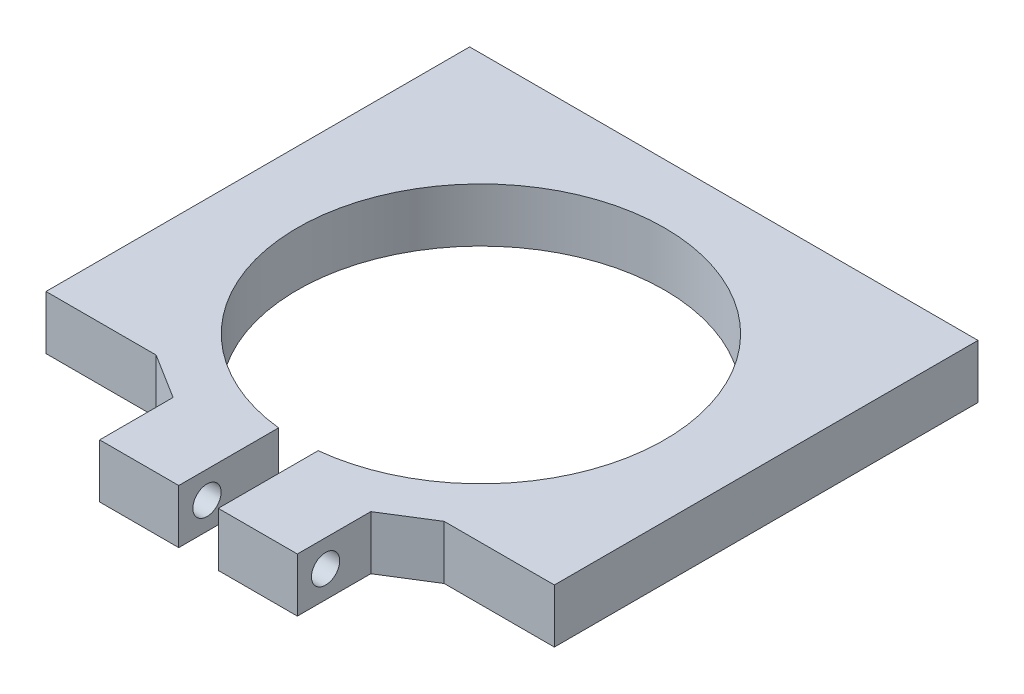
from build123d import *

# Parameters (mm, degrees)
ESBO_O1_W                = 90
ESBO_O1_H                = 93
RESSALTO_EXTRUS_O1_DEPTH = 9.53
ESBO_O3_R                = 32.51
CORTE_EXTRUS_O2_DEPTH    = 66.406963697
ESBO_O2_R                = 2
CORTE_EXTRUS_O1_DEPTH    = 19
CORTE_EXTRUS_O4_REACH    = 67.407
ESBO_O5_W                = 27.5
ESBO_O5_H                = 13
CORTE_EXTRUS_O5_REACH    = 67.407
ESBO_O6_W                = 7
ESBO_O6_H                = 26.329700269
CORTE_EXTRUS_O6_REACH    = 80.481
ESBO_O7_R                = 2.5
CORTE_EXTRUS_O8_DEPTH    = 66.406963697


with BuildPart() as part:
    # Esboço1 → Ressalto-extrusão1 (new body)
    with BuildSketch(Plane(origin=(0, 0, 0), x_dir=(1, 0, 0), z_dir=(0, 1, 0))):
        Rectangle(ESBO_O1_W, ESBO_O1_H)
    extrude(amount=RESSALTO_EXTRUS_O1_DEPTH)

    # Esboço3 → Corte-extrusão2 (cut, through all)
    with BuildSketch(Plane(origin=(0, 9.53, 0), x_dir=(1, 0, 0), z_dir=(0, 1, 0))):
        with Locations(Location((0, 3.5, 0), (0, 0, 270))):
            Circle(ESBO_O3_R)
    extrude(amount=-CORTE_EXTRUS_O2_DEPTH, mode=Mode.SUBTRACT)

    # Esboço2 → Corte-extrusão1 (cut)
    with BuildSketch(Plane(origin=(0, 0, -46.5), x_dir=(-1, 0, 0), z_dir=(0, 0, -1))):
        with Locations((-40, 4.765)):
            Circle(ESBO_O2_R)
        with Locations((-25, 4.765)):
            Circle(ESBO_O2_R)
        with Locations((25, 4.765)):
            Circle(ESBO_O2_R)
        with Locations((40, 4.765)):
            Circle(ESBO_O2_R)
    extrude(amount=-CORTE_EXTRUS_O1_DEPTH, mode=Mode.SUBTRACT)

    # Esboço5 → Corte-extrusão4 (cut, up to next)
    with BuildSketch(Plane(origin=(0, 9.53, 0), x_dir=(1, 0, 0), z_dir=(0, 1, 0)), mode=Mode.PRIVATE) as corte_extrus_o4_sk1:
        with Locations((31.25, -40)):
            Rectangle(ESBO_O5_W, ESBO_O5_H)
    corte_extrus_o4_tool1 = extrude(corte_extrus_o4_sk1.sketch, amount=-CORTE_EXTRUS_O4_REACH, mode=Mode.PRIVATE) & part.part
    # Esboço5 → Corte-extrusão4 (cut, up to next)
    with BuildSketch(Plane(origin=(0, 9.53, 0), x_dir=(1, 0, 0), z_dir=(0, 1, 0)), mode=Mode.PRIVATE) as corte_extrus_o4_sk2:
        with Locations((-31.25, -40)):
            Rectangle(ESBO_O5_W, ESBO_O5_H)
    corte_extrus_o4_tool2 = extrude(corte_extrus_o4_sk2.sketch, amount=-CORTE_EXTRUS_O4_REACH, mode=Mode.PRIVATE) & part.part
    add(corte_extrus_o4_tool1.solids().sort_by_distance((31.25, 9.53, 40))[0], mode=Mode.SUBTRACT)
    add(corte_extrus_o4_tool2.solids().sort_by_distance((-31.25, 9.53, 40))[0], mode=Mode.SUBTRACT)

    # Esboço6 → Corte-extrusão5 (cut, up to next)
    with BuildSketch(Plane(origin=(0, 9.53, 0), x_dir=(1, 0, 0), z_dir=(0, 1, 0)), mode=Mode.PRIVATE) as corte_extrus_o5_sk1:
        with Locations((0, -33.335149866)):
            Rectangle(ESBO_O6_W, ESBO_O6_H)
    corte_extrus_o5_tool1 = extrude(corte_extrus_o5_sk1.sketch, amount=-CORTE_EXTRUS_O5_REACH, mode=Mode.PRIVATE) & part.part
    add(corte_extrus_o5_tool1.solids().sort_by_distance((0, 9.53, 33.33515))[0], mode=Mode.SUBTRACT)

    # Corte-extrusão6: up to this face of the body (flat: up to its plane)
    corte_extrus_o6_end = Plane(part.part.faces().sort_by_distance((17.5, 4.765, 40))[0])
    # Esboço7 → Corte-extrusão6 (cut, up to the picked face)
    with BuildSketch(Plane.ZY.offset(17.5), mode=Mode.PRIVATE) as corte_extrus_o6_sk1:
        with Locations((41.5, 4.765)):
            Circle(ESBO_O7_R)
    corte_extrus_o6_tool1 = split(extrude(corte_extrus_o6_sk1.sketch, amount=-CORTE_EXTRUS_O6_REACH, mode=Mode.PRIVATE), bisect_by=corte_extrus_o6_end, keep=Keep.BOTH, mode=Mode.PRIVATE)
    add(corte_extrus_o6_tool1.solids().sort_by(Axis((-17.5, 4.765, 41.5), (1, 0, 0)))[0], mode=Mode.SUBTRACT)

    # Esboço9 → Corte-extrusão8 (cut, through all)
    with BuildSketch(Plane(origin=(0, 9.53, 0), x_dir=(-1, 0, 0), z_dir=(0, 1, 0))):
        Polygon((45, 28.5), (25.5, 28.5), (17.5, 33.5), (45, 33.5), align=None)
        Polygon((-25.5, 28.5), (-17.5, 33.5), (-45, 33.5), (-45, 28.5), align=None)
    extrude(amount=-CORTE_EXTRUS_O8_DEPTH, mode=Mode.SUBTRACT)


solid = part.part
